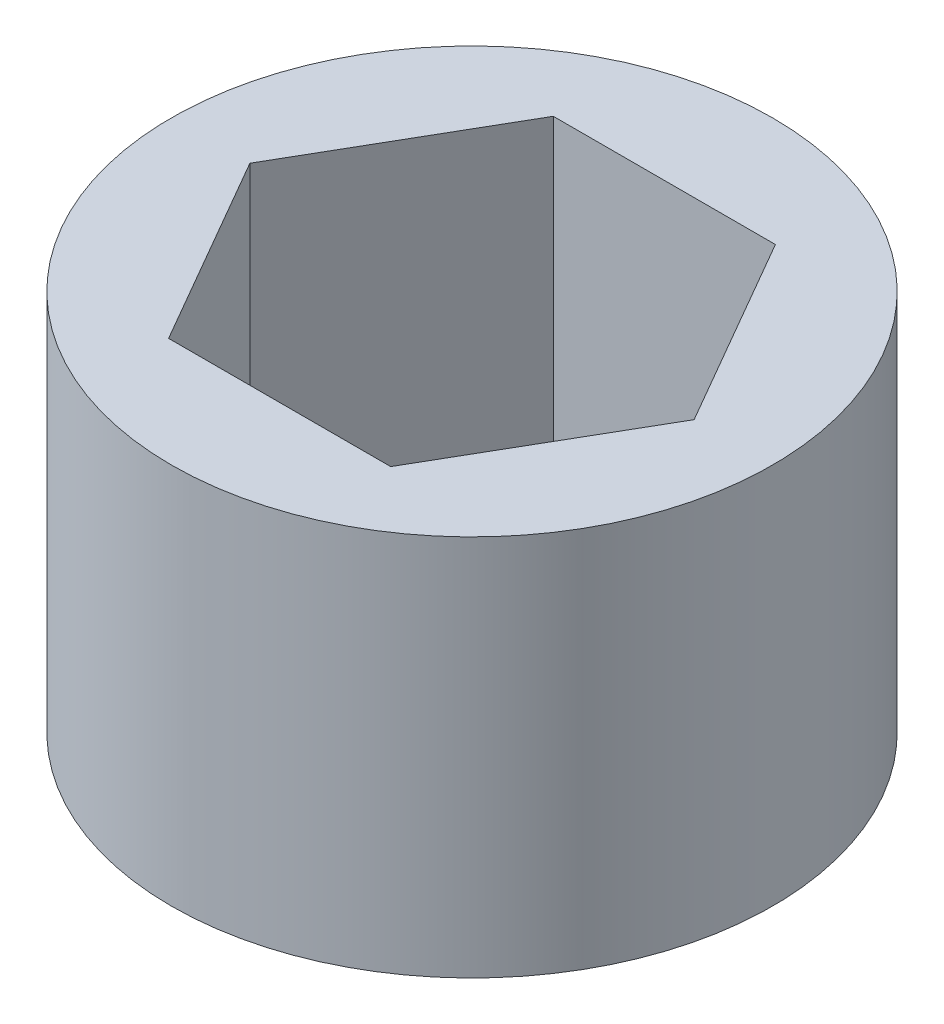
from build123d import *

# Parameters (mm, degrees)
SKETCH1_R           = 9.9949
BOSS_EXTRUDE1_DEPTH = 12.7


with BuildPart() as part:
    # Sketch1 → Boss-Extrude1 (new body)
    with BuildSketch(Plane(origin=(0, 0, 0), x_dir=(1, 0, 0), z_dir=(0, 1, 0))):
        with Locations(Location((0, 0, 0), (0, 0, 270))):
            Circle(SKETCH1_R)
        Polygon((7.383674858, 0), (3.691837429, 6.39445), (-3.691837429, 6.39445), (-7.383674858, 0), (-3.691837429, -6.39445), (3.691837429, -6.39445), align=None, mode=Mode.SUBTRACT)
    extrude(amount=BOSS_EXTRUDE1_DEPTH)


solid = part.part
